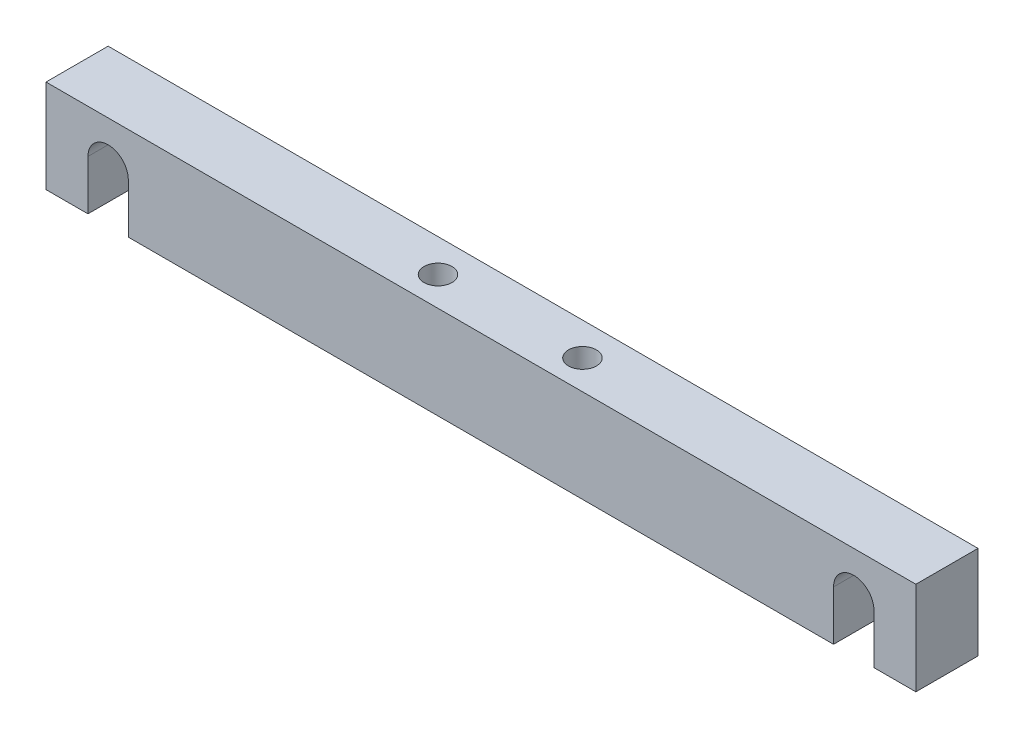
from build123d import *

# Parameters (mm, degrees)
SKIZZE1_W                                            = 140
SKIZZE1_H                                            = 10
AUFSATZ_LINEAR_AUSTRAGEN1_DEPTH                      = 15
SCHNITT_LINEAR_AUSTRAGEN1_DEPTH                      = 15
FORMSENKUNG_F_R_M4_SENKSCHRAUBE_MIT_INNE_D           = 4.5
FORMSENKUNG_F_R_M4_SENKSCHRAUBE_MIT_INNE_CSINK_D     = 9.18
FORMSENKUNG_F_R_M4_SENKSCHRAUBE_MIT_INNE_CSINK_ANGLE = 90


with BuildPart() as part:
    # Skizze1 → Aufsatz-Linear austragen1 (new body)
    with BuildSketch(Plane(origin=(0, 0, 0), x_dir=(1, 0, 0), z_dir=(0, 1, 0))):
        with Locations((93.874498843, 0.286555153)):
            Rectangle(SKIZZE1_W, SKIZZE1_H)
    extrude(amount=AUFSATZ_LINEAR_AUSTRAGEN1_DEPTH)

    # Skizze2 → Schnitt-Linear austragen1 (cut)
    with BuildSketch(Plane(origin=(0, 0, -5.286555153), x_dir=(-1, 0, 0), z_dir=(0, 0, -1))):
        with BuildLine():
            Line((-37.124498843, 8), (-37.124498843, 0))
            Line((-37.124498843, 0), (-30.624498843, 0))
            Line((-30.624498843, 0), (-30.624498843, 8))
            ThreePointArc((-30.624498843, 8), (-33.874498843, 11.25), (-37.124498843, 8))
        make_face()
        with BuildLine():
            Line((-157.124498843, 8), (-157.124498843, -0.120378635))
            Line((-157.124498843, -0.120378635), (-150.624498843, -0.120378635))
            Line((-150.624498843, -0.120378635), (-150.624498843, 8))
            ThreePointArc((-150.624498843, 8), (-153.874498843, 11.25), (-157.124498843, 8))
        make_face()
    extrude(amount=-SCHNITT_LINEAR_AUSTRAGEN1_DEPTH, mode=Mode.SUBTRACT)

    # Formsenkung für M4 Senkschraube mit Innensechskant1 (through all)
    with Locations(Plane(origin=(82.249498843, 0, 0), x_dir=(0, 0, -1), z_dir=(0, -1, 0))):
        with Locations((0, 0), (0, 23.25)):
            CounterSinkHole(FORMSENKUNG_F_R_M4_SENKSCHRAUBE_MIT_INNE_D / 2, FORMSENKUNG_F_R_M4_SENKSCHRAUBE_MIT_INNE_CSINK_D / 2, counter_sink_angle=FORMSENKUNG_F_R_M4_SENKSCHRAUBE_MIT_INNE_CSINK_ANGLE)


solid = part.part
